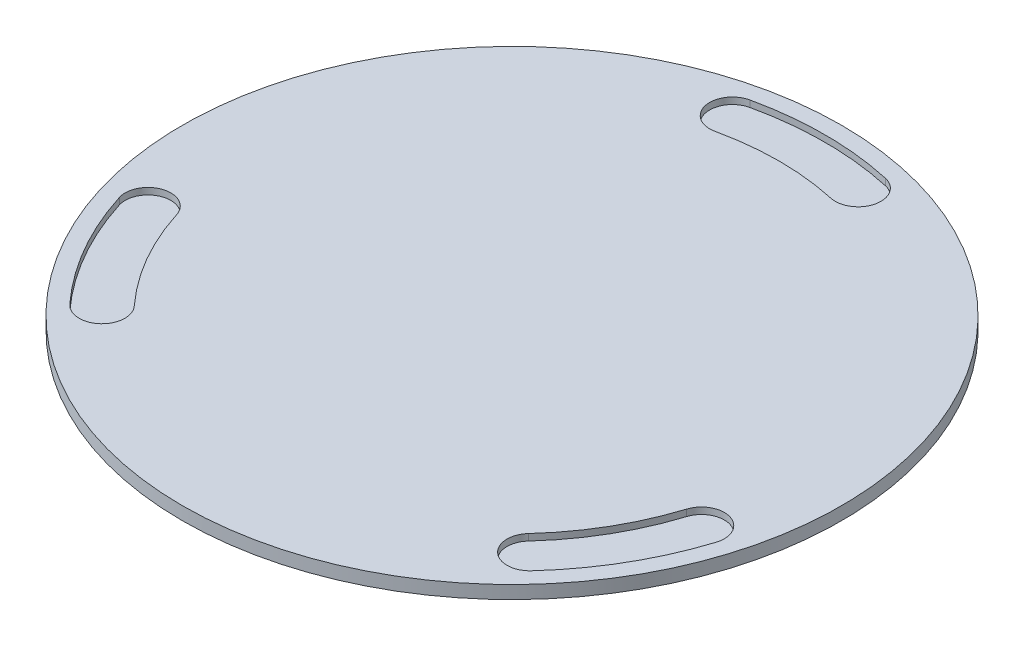
from build123d import *

# Parameters (mm, degrees)
SKETCH1_R           = 50.5
BOSS_EXTRUDE1_DEPTH = 1
CUT_EXTRUDE1_DEPTH  = 1
CIRPATTERN1_COUNT   = 3


with BuildPart() as part:
    # Sketch1 → Boss-Extrude1 (new, symmetric)
    with BuildSketch(Plane(origin=(0, 0, 0), x_dir=(1, 0, 0), z_dir=(0, 1, 0))):
        with Locations(Location((0, 0, 0), (0, 0, 270))):
            Circle(SKETCH1_R)
    extrude(amount=BOSS_EXTRUDE1_DEPTH, both=True)

    # Sketch2 → Cut-Extrude1 (cut)
    with BuildSketch(Plane(origin=(0, 1, 0), x_dir=(1, 0, 0), z_dir=(0, 1, 0))):
        with BuildLine():
            ThreePointArc((10.381410523, 46.827516727), (0, 47.96446609), (-10.381410523, 46.827516727))
            ThreePointArc((-10.381410523, 46.827516727), (-13.040907899, 42.652942054), (-8.866333226, 39.993444677))
            ThreePointArc((-8.866333226, 39.993444677), (0, 40.96446609), (8.866333226, 39.993444677))
            ThreePointArc((8.866333226, 39.993444677), (13.040907899, 42.652942054), (10.381410523, 46.827516727))
        make_face()
    cut_extrude1 = extrude(amount=-CUT_EXTRUDE1_DEPTH, mode=Mode.SUBTRACT)

    # CirPattern1: Cut-Extrude1 ×3 about axis
    cirpattern1_axis = Axis((0, 0, 0), (0, 1, 0))
    for i in range(1, CIRPATTERN1_COUNT):
        add(cut_extrude1.rotate(cirpattern1_axis, i * 360 / CIRPATTERN1_COUNT), mode=Mode.SUBTRACT)


solid = part.part
